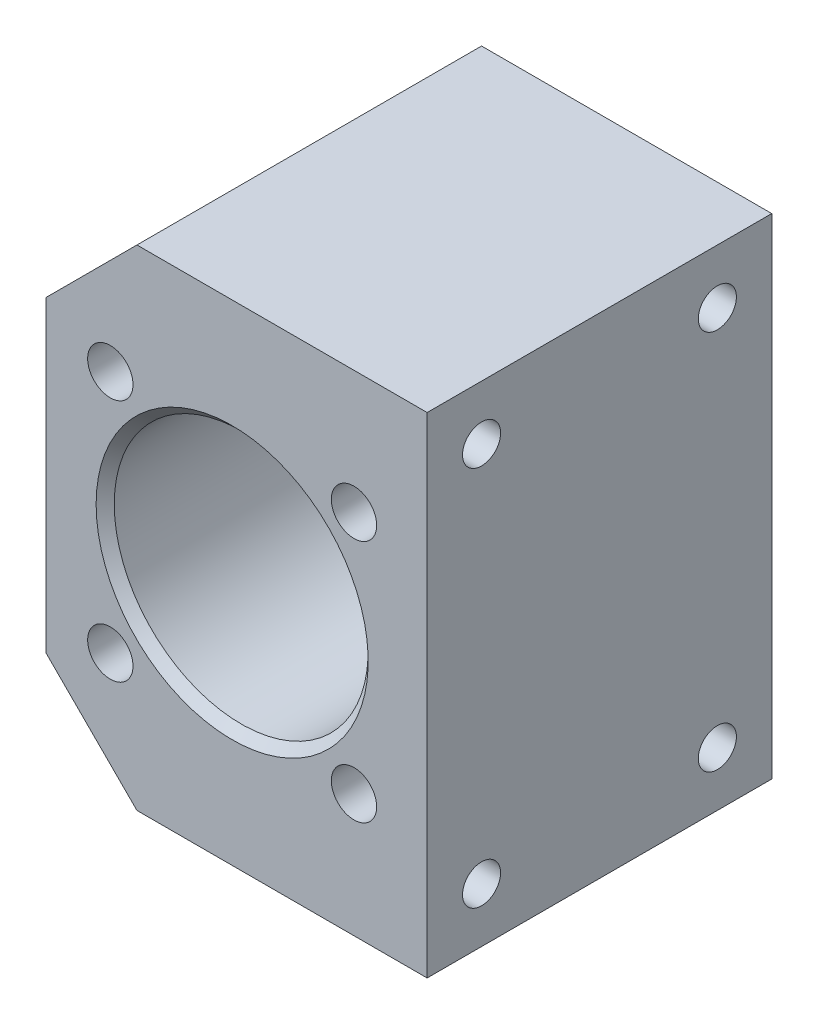
from build123d import *

# Parameters (mm, degrees)
SZKIC1_W                       = 42
SZKIC1_H                       = 54
SZKIC1_R                       = 14
DODANIE_WYCI_GNI_CIE1_DEPTH    = 38
SFAZOWANIE1_SIZE               = 1
OTW_R_GWINTOWANY_M6X1_01_D     = 5
OTW_R_GWINTOWANY_M6X1_01_DEPTH = 17
OTW_R_GWINTOWANY_M6X1_01_TIP   = 1.502151548
OTW_R_GWINTOWANY_M5X0_81_D     = 4.2
OTW_R_GWINTOWANY_M5X0_81_DEPTH = 25
OTW_R_GWINTOWANY_M5X0_81_TIP   = 1.2618073
SFAZOWANIE2_SIZE               = 10


with BuildPart() as part:
    # Szkic1 → Dodanie-wyciągnięcie1 (new body)
    with BuildSketch(Plane.XY):
        with Locations((21, 27)):
            Rectangle(SZKIC1_W, SZKIC1_H)
        with Locations((20.5, 27)):
            Circle(SZKIC1_R, mode=Mode.SUBTRACT)
    extrude(amount=DODANIE_WYCI_GNI_CIE1_DEPTH)

    # Sfazowanie1
    sfazowanie1_edges = [part.edges().sort_by_distance(p)[0] for p in [
        (6.5, 27, 0),
        (6.5, 27, 38),
    ]]
    chamfer(sfazowanie1_edges, length=SFAZOWANIE1_SIZE)

    # Otwór gwintowany M6x1.01
    with Locations(Plane.XY.offset(38)):
        with Locations((33.935028843, 40.435028843), (7.064971157, 40.435028843), (7.064971157, 13.564971157), (33.935028843, 13.564971157)):
            Hole(OTW_R_GWINTOWANY_M6X1_01_D / 2, depth=OTW_R_GWINTOWANY_M6X1_01_DEPTH)
            with Locations((0, 0, -(OTW_R_GWINTOWANY_M6X1_01_DEPTH + OTW_R_GWINTOWANY_M6X1_01_TIP / 2))):  # 118° drill point
                Cone(0, OTW_R_GWINTOWANY_M6X1_01_D / 2, OTW_R_GWINTOWANY_M6X1_01_TIP, mode=Mode.SUBTRACT)

    # Otwór gwintowany M5x0.81
    with Locations(Plane(origin=(42, 0, 0), x_dir=(0, 0, -1), z_dir=(1, 0, 0))):
        with Locations((-32, 48), (-6, 48), (-6, 6), (-32, 6)):
            Hole(OTW_R_GWINTOWANY_M5X0_81_D / 2, depth=OTW_R_GWINTOWANY_M5X0_81_DEPTH)
            with Locations((0, 0, -(OTW_R_GWINTOWANY_M5X0_81_DEPTH + OTW_R_GWINTOWANY_M5X0_81_TIP / 2))):  # 118° drill point
                Cone(0, OTW_R_GWINTOWANY_M5X0_81_D / 2, OTW_R_GWINTOWANY_M5X0_81_TIP, mode=Mode.SUBTRACT)

    # Sfazowanie2
    sfazowanie2_edges = [part.edges().sort_by_distance(p)[0] for p in [
        (0, 54, 19),
        (0, 0, 19),
    ]]
    chamfer(sfazowanie2_edges, length=SFAZOWANIE2_SIZE)


solid = part.part
